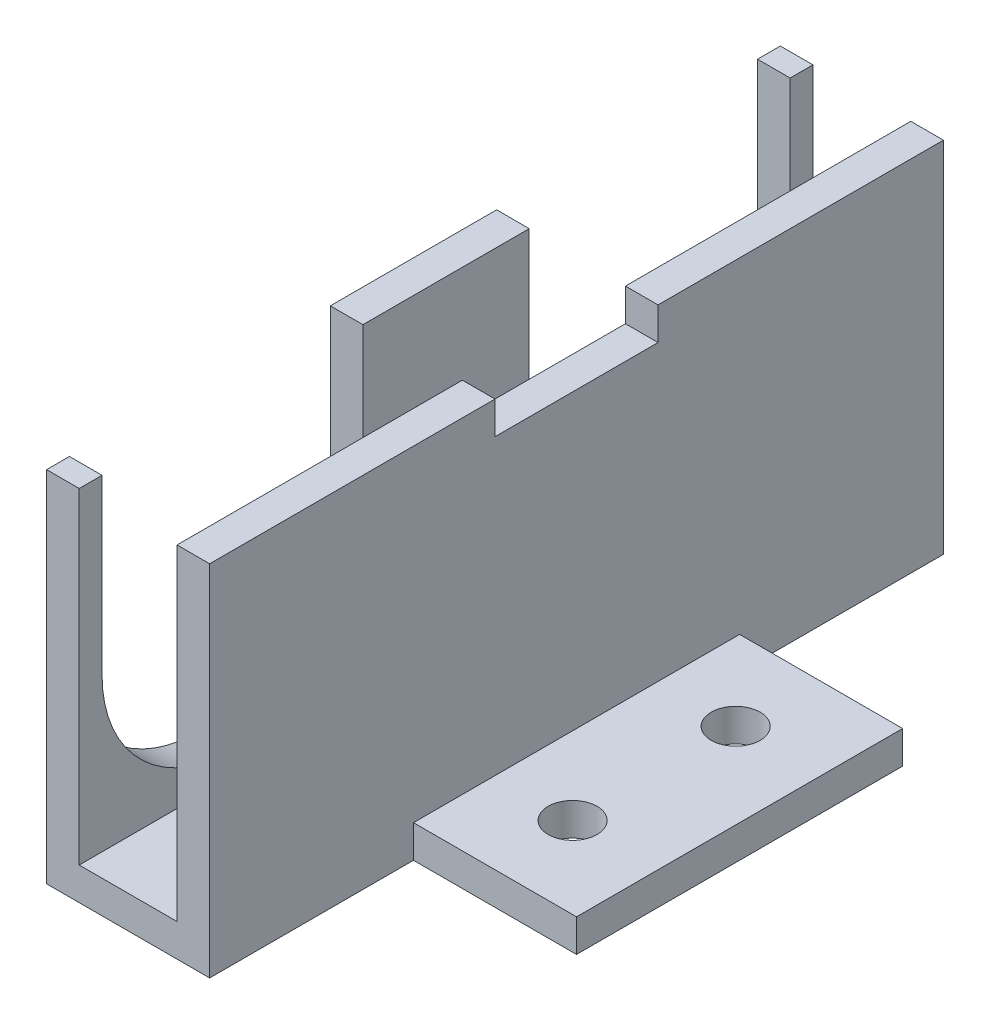
from build123d import *

# Parameters (mm, degrees)
BOSS_EXTRUDE1_DEPTH = 45
CUT_EXTRUDE1_DEPTH  = 2
SKETCH4_W           = 10
SKETCH4_H           = 2
CUT_EXTRUDE2_DEPTH  = 2
SKETCH5_W           = 20
SKETCH5_H           = 2
BOSS_EXTRUDE2_DEPTH = 10
SKETCH6_R           = 1.5
CUT_EXTRUDE3_DEPTH  = 2


with BuildPart() as part:
    # Sketch1 → Boss-Extrude1 (new body)
    with BuildSketch(Plane.XY):
        Polygon((0, 0), (6, 0), (6, 20), (8, 20), (8, -2), (-2, -2), (-2, 20), (0, 20), align=None)
    extrude(amount=BOSS_EXTRUDE1_DEPTH)

    # Sketch3 → Cut-Extrude1 (cut)
    with BuildSketch(Plane.ZY.offset(2)):
        with BuildLine():
            ThreePointArc((43.6, 9.407510361), (35.6, 17.407510361), (27.6, 9.407510361))
            Line((27.6, 9.407510361), (43.6, 9.407510361))
        make_face()
        with BuildLine():
            Line((43.6, 9.407510361), (27.6, 9.407510361))
            ThreePointArc((27.6, 9.407510361), (35.6, 1.407510361), (43.6, 9.407510361))
        make_face()
        with BuildLine():
            Line((1.4, 20), (1.4, 9.407510361))
            ThreePointArc((1.4, 9.407510361), (9.4, 17.407510361), (17.4, 9.407510361))
            Line((17.4, 9.407510361), (17.4, 20))
            Line((17.4, 20), (1.4, 20))
        make_face()
        with BuildLine():
            ThreePointArc((17.4, 9.407510361), (9.4, 17.407510361), (1.4, 9.407510361))
            Line((1.4, 9.407510361), (17.4, 9.407510361))
        make_face()
        with BuildLine():
            Line((17.4, 9.407510361), (1.4, 9.407510361))
            ThreePointArc((1.4, 9.407510361), (9.4, 1.407510361), (17.4, 9.407510361))
        make_face()
        with BuildLine():
            Line((43.6, 20), (27.6, 20))
            Line((27.6, 20), (27.6, 9.407510361))
            ThreePointArc((27.6, 9.407510361), (35.6, 17.407510361), (43.6, 9.407510361))
            Line((43.6, 9.407510361), (43.6, 20))
        make_face()
    extrude(amount=-CUT_EXTRUDE1_DEPTH, mode=Mode.SUBTRACT)

    # Sketch4 → Cut-Extrude2 (cut)
    with BuildSketch(Plane(origin=(8, 0, 0), x_dir=(0, 0, -1), z_dir=(1, 0, 0))):
        with Locations((-22.5, 19)):
            Rectangle(SKETCH4_W, SKETCH4_H)
    extrude(amount=-CUT_EXTRUDE2_DEPTH, mode=Mode.SUBTRACT)

    # Sketch5 → Boss-Extrude2 (add)
    with BuildSketch(Plane(origin=(8, 0, 0), x_dir=(0, 0, -1), z_dir=(1, 0, 0))):
        with Locations((-22.5, -1)):
            Rectangle(SKETCH5_W, SKETCH5_H)
    extrude(amount=BOSS_EXTRUDE2_DEPTH)

    # Sketch6 → Cut-Extrude3 (cut)
    with BuildSketch(Plane(origin=(0, 0, 0), x_dir=(1, 0, 0), z_dir=(0, 1, 0))):
        with Locations(Location((12.760241106, -27.5, 0), (0, 0, 180))):
            Circle(SKETCH6_R)
        with Locations(Location((12.760241106, -17.5, 0), (0, 0, 180))):
            Circle(SKETCH6_R)
    extrude(amount=-CUT_EXTRUDE3_DEPTH, mode=Mode.SUBTRACT)


solid = part.part
